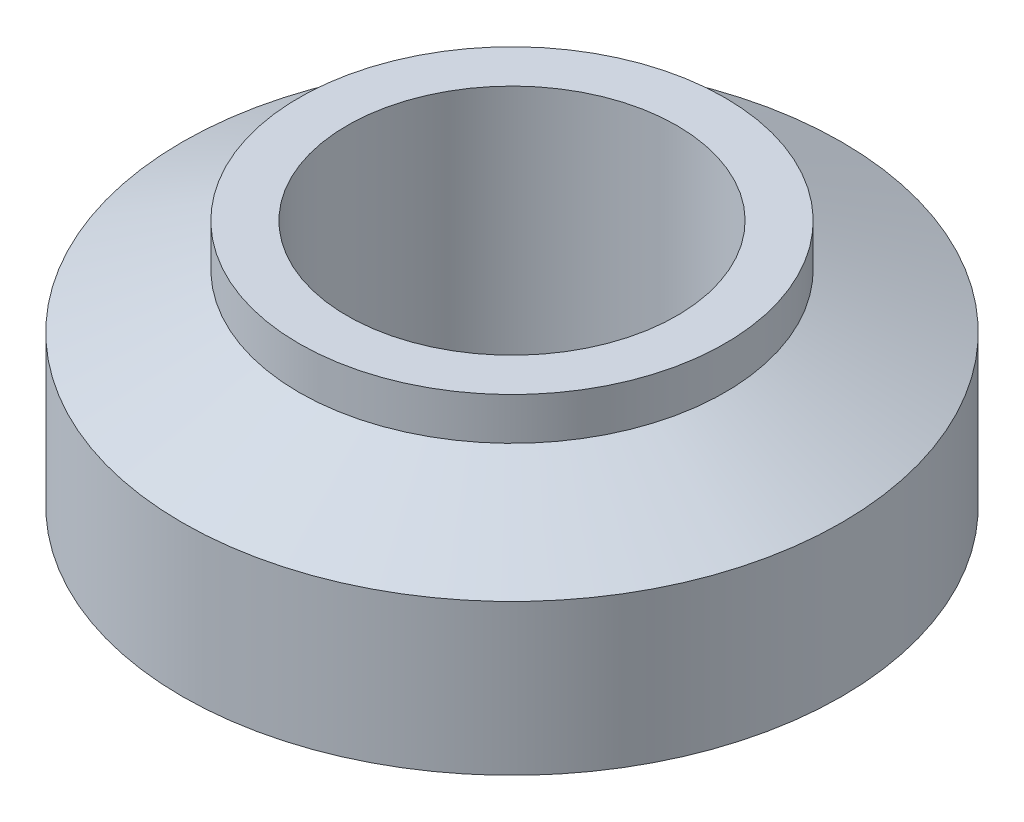
from build123d import *


with BuildPart() as part:
    # Sketch1 → Revolve1 (revolve)
    with BuildSketch(Plane(origin=(0, 0, 0), x_dir=(0, 0, -1), z_dir=(1, 0, 0))):
        Polygon((1.291976655, -2.257525487), (2, -2.587682195), (2, -3.501099698), (1, -3.501099698), (1, -2.257525487), (1, -2.001099698), (1.291976655, -2.001099698), align=None)
    revolve(axis=Axis((0, 0, 0), (0, 1, 0)))


solid = part.part
